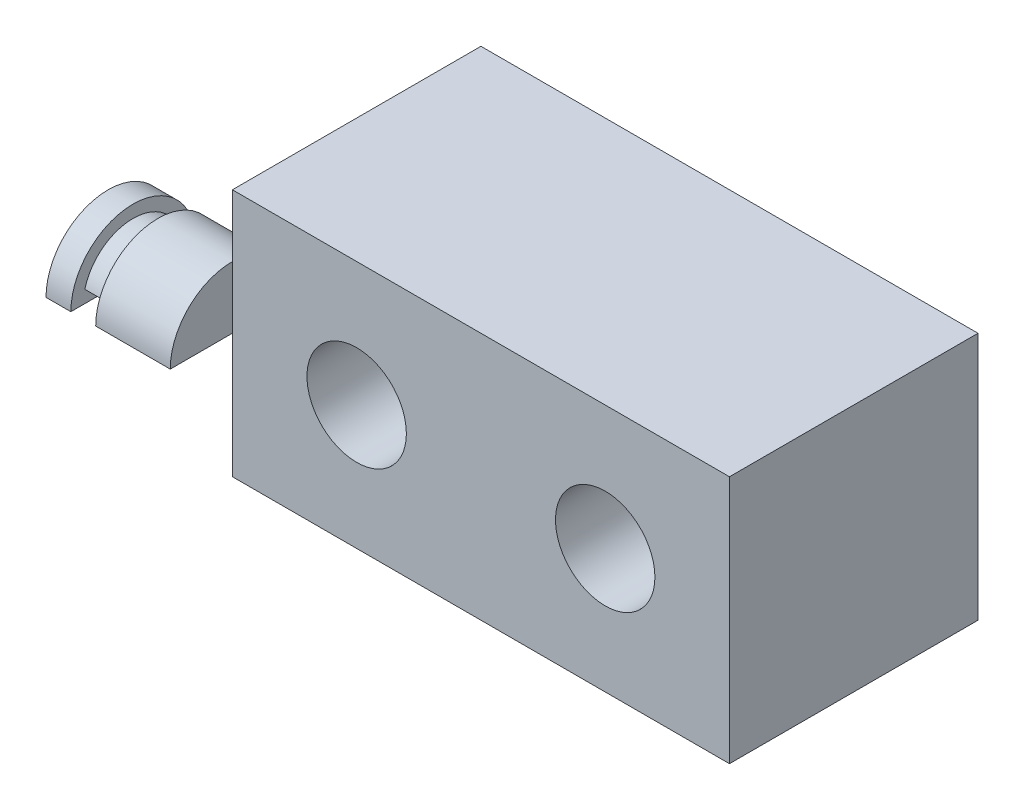
from build123d import *

# Parameters (mm, degrees)
SKETCH1_W           = 50.8
SKETCH1_H           = 25.4
BOSS_EXTRUDE1_DEPTH = 25.4
SKETCH2_R           = 5.08
CUT_EXTRUDE1_DEPTH  = 13.97
BOSS_EXTRUDE2_DEPTH = 12.7
CUT_EXTRUDE3_START  = -7.62
CUT_EXTRUDE3_DEPTH  = 2.54


with BuildPart() as part:
    # Sketch1 → Boss-Extrude1 (new body)
    with BuildSketch(Plane(origin=(0, 0, 0), x_dir=(1, 0, 0), z_dir=(0, 1, 0))):
        with Locations((25.4, 12.7)):
            Rectangle(SKETCH1_W, SKETCH1_H)
    extrude(amount=-BOSS_EXTRUDE1_DEPTH)

    # Sketch2 → Cut-Extrude1 (cut)
    with BuildSketch(Plane.XY):
        with Locations((12.7, -12.7)):
            Circle(SKETCH2_R)
        with Locations((38.1, -12.7)):
            Circle(SKETCH2_R)
    extrude(amount=-CUT_EXTRUDE1_DEPTH, mode=Mode.SUBTRACT)

    # Sketch3 → Boss-Extrude2 (add)
    with BuildSketch(Plane(origin=(0, 0, 0), x_dir=(0, 0, -1), z_dir=(1, 0, 0))):
        with BuildLine():
            Line((-6.35, -12.7), (6.35, -12.7))
            ThreePointArc((6.35, -12.7), (0, -6.35), (-6.35, -12.7))
        make_face()
    extrude(amount=-BOSS_EXTRUDE2_DEPTH)

    # Sketch4 → Cut-Extrude3 (cut)
    with BuildSketch(Plane(origin=(0, 0, 0), x_dir=(0, 0, -1), z_dir=(1, 0, 0)).offset(CUT_EXTRUDE3_START)):
        with BuildLine():
            Line((-6.35, -12.7), (6.35, -12.7))
            ThreePointArc((6.35, -12.7), (0, -6.35), (-6.35, -12.7))
        make_face()
        with BuildLine():
            Line((-4.91868885, -11.43), (4.91868885, -11.43))
            ThreePointArc((4.91868885, -11.43), (0, -7.62), (-4.91868885, -11.43))
        make_face(mode=Mode.SUBTRACT)
    extrude(amount=-CUT_EXTRUDE3_DEPTH, mode=Mode.SUBTRACT)


solid = part.part
